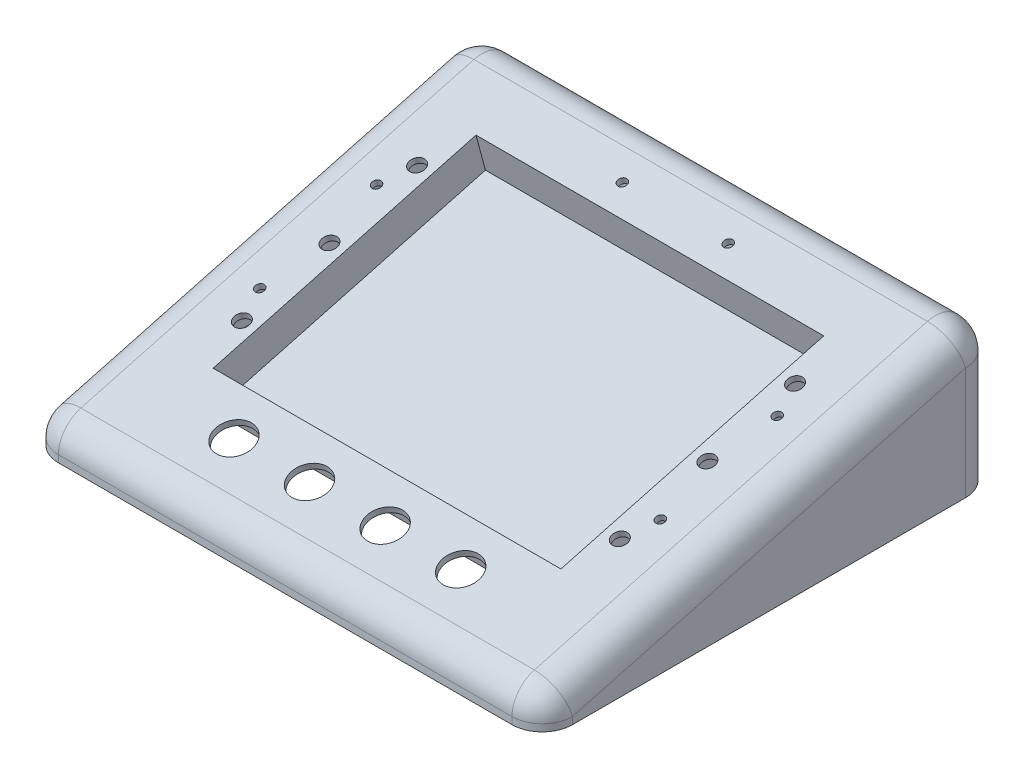
from build123d import *

# Parameters (mm, degrees)
SKETCH1_W                                  = 170
SKETCH1_H                                  = 150
BOSS_EXTRUDE1_DEPTH                        = 10
BOSS_EXTRUDE2_DEPTH                        = 170
FILLET1_R                                  = 10
SHELL1_T                                   = -2
SKETCH3_W                                  = 115
SKETCH3_H                                  = 90
CUT_EXTRUDE1_DEPTH                         = 2
SKETCH4_W                                  = 119
SKETCH4_H                                  = 94
SKETCH4_W_2                                = 115
SKETCH4_H_2                                = 90
BOSS_EXTRUDE3_DEPTH                        = 10
SKETCH5_W                                  = 119
SKETCH5_H                                  = 94
BOSS_EXTRUDE4_DEPTH                        = 2
SKETCH6_R                                  = 2.5
CUT_EXTRUDE2_DEPTH                         = 2
SKETCH7_R                                  = 6
CUT_EXTRUDE3_DEPTH                         = 2
SKETCH9_W                                  = 10
SKETCH9_H                                  = 15
BOSS_EXTRUDE5_DEPTH                        = 10
SKETCH10_W                                 = 5
SKETCH10_H                                 = 10
CUT_EXTRUDE4_DEPTH                         = 5
MIRROR1_AT_THE_SECOND_PLANE_COPY_1_SKETC_W = 10
MIRROR1_AT_THE_SECOND_PLANE_COPY_1_SKETC_H = 15
MIRROR1_AT_THE_SECOND_PLANE_COPY_1_DEPTH   = 10
MIRROR1_AT_THE_SECOND_PLANE_COPY_2_SKETC_W = 5
MIRROR1_AT_THE_SECOND_PLANE_COPY_2_SKETC_H = 10
MIRROR1_AT_THE_SECOND_PLANE_COPY_2_DEPTH   = 5
FILLET2_R                                  = 2
SKETCH11_R                                 = 1.5
CUT_EXTRUDE5_DEPTH                         = 2


with BuildPart() as part:
    # Sketch1 → Boss-Extrude1 (new body)
    with BuildSketch(Plane(origin=(0, 0, 0), x_dir=(1, 0, 0), z_dir=(0, 1, 0))):
        Rectangle(SKETCH1_W, SKETCH1_H)
    extrude(amount=BOSS_EXTRUDE1_DEPTH)

    # Sketch2 → Boss-Extrude2 (add)
    with BuildSketch(Plane.ZY.offset(85)):
        Polygon((-75, 10), (-75, 50.192378865), (75, 10), align=None)
    extrude(amount=-BOSS_EXTRUDE2_DEPTH)

    # Fillet1
    fillet1_edges = [part.edges().sort_by_distance(p)[0] for p in [
        (0, 50.192378865, -75),
        (-85, 30.096189432, 0),
        (85, 30.096189432, 0),
        (0, 10, 75),
        (85, 5, 75),
        (-85, 5, 75),
        (-85, 25.096189432, -75),
        (85, 25.096189432, -75),
    ]]
    fillet(fillet1_edges, radius=FILLET1_R)

    # Shell1
    shell1_openings = [part.faces().sort_by_distance(p)[0] for p in [
        (0, 0, 0),
    ]]
    offset(amount=SHELL1_T, openings=shell1_openings, kind=Kind.INTERSECTION)

    # Sketch3 → Cut-Extrude1 (cut)
    with BuildSketch(Plane(origin=(0, 28.080127019, 7.524047358), x_dir=(1, 0, 0), z_dir=(0, 0.96592582628907, 0.25881904510251436))):
        with Locations((0, 10)):
            Rectangle(SKETCH3_W, SKETCH3_H)
    extrude(amount=-CUT_EXTRUDE1_DEPTH, mode=Mode.SUBTRACT)

    # Sketch4 → Boss-Extrude3 (add)
    with BuildSketch(Plane(origin=(0, 26.148275366, 7.006409268), x_dir=(1, 0, 0), z_dir=(0, -0.96592582628907, -0.25881904510251436))):
        with Locations((0, -10)):
            Rectangle(SKETCH4_W, SKETCH4_H)
        with Locations((0, -10)):
            Rectangle(SKETCH4_W_2, SKETCH4_H_2, mode=Mode.SUBTRACT)
    extrude(amount=BOSS_EXTRUDE3_DEPTH)

    # Sketch5 → Boss-Extrude4 (add)
    with BuildSketch(Plane(origin=(0, 16.489017103, 4.418218817), x_dir=(1, 0, 0), z_dir=(0, -0.96592582628907, -0.25881904510251436))):
        with Locations((0, -10)):
            Rectangle(SKETCH5_W, SKETCH5_H)
    extrude(amount=BOSS_EXTRUDE4_DEPTH)

    # Sketch6 → Cut-Extrude2 (cut)
    with BuildSketch(Plane(origin=(0, 28.080127019, 7.524047358), x_dir=(1, 0, 0), z_dir=(0, 0.96592582628907, 0.25881904510251436))):
        with Locations(Location((-62.5, 10, 0), (0, 0, 270))):
            Circle(SKETCH6_R)
        with Locations(Location((-62.5, 40, 0), (0, 0, 270))):
            Circle(SKETCH6_R)
        with Locations(Location((-62.5, -20, 0), (0, 0, 270))):
            Circle(SKETCH6_R)
        with Locations(Location((62.5, -20, 0), (0, 0, 270))):
            Circle(SKETCH6_R)
        with Locations(Location((62.5, 40, 0), (0, 0, 270))):
            Circle(SKETCH6_R)
        with Locations(Location((62.5, 10, 0), (0, 0, 270))):
            Circle(SKETCH6_R)
    extrude(amount=-CUT_EXTRUDE2_DEPTH, mode=Mode.SUBTRACT)

    # Sketch7 → Cut-Extrude3 (cut)
    with BuildSketch(Plane(origin=(0, 28.080127019, 7.524047358), x_dir=(1, 0, 0), z_dir=(0, 0.96592582628907, 0.25881904510251436))):
        with Locations(Location((-12.5, -48.59148832, 0), (0, 0, 270))):
            Circle(SKETCH7_R)
        with Locations(Location((12.5, -48.59148832, 0), (0, 0, 270))):
            Circle(SKETCH7_R)
        with Locations(Location((37.5, -48.59148832, 0), (0, 0, 270))):
            Circle(SKETCH7_R)
        with Locations(Location((-37.5, -48.59148832, 0), (0, 0, 270))):
            Circle(SKETCH7_R)
    extrude(amount=-CUT_EXTRUDE3_DEPTH, mode=Mode.SUBTRACT)

    # Sketch9 → Boss-Extrude5 (add)
    with BuildSketch(Plane.XZ):
        with Locations((-78, -47.5)):
            Rectangle(SKETCH9_W, SKETCH9_H)
    boss_extrude5 = extrude(amount=-BOSS_EXTRUDE5_DEPTH)

    # Sketch10 → Cut-Extrude4 (cut)
    with BuildSketch(Plane.XZ):
        with Locations((-78, -47.5)):
            Rectangle(SKETCH10_W, SKETCH10_H)
    cut_extrude4 = extrude(amount=-CUT_EXTRUDE4_DEPTH, mode=Mode.SUBTRACT)

    # Mirror1: Boss-Extrude5, Cut-Extrude4 across plane
    add(boss_extrude5.mirror(Plane(origin=(0, 0, 0), x_dir=(0, 0, 1), z_dir=(1, 0, 0))))
    add(cut_extrude4.mirror(Plane(origin=(0, 0, 0), x_dir=(0, 0, 1), z_dir=(1, 0, 0))), mode=Mode.SUBTRACT)

    # Mirror1 at the second plane: Boss-Extrude5, Cut-Extrude4 across plane
    add(boss_extrude5.mirror(Plane.XY))
    add(cut_extrude4.mirror(Plane.XY), mode=Mode.SUBTRACT)

    # Mirror1 at the second plane copy 1 sketc → Mirror1 at the second plane copy 1 (add)
    with BuildSketch(Plane(origin=(0, 0, 0), x_dir=(-1, 0, 0), z_dir=(0, -1, 0))):
        with Locations((-78, -47.5)):
            Rectangle(MIRROR1_AT_THE_SECOND_PLANE_COPY_1_SKETC_W, MIRROR1_AT_THE_SECOND_PLANE_COPY_1_SKETC_H)
    extrude(amount=-MIRROR1_AT_THE_SECOND_PLANE_COPY_1_DEPTH)

    # Mirror1 at the second plane copy 2 sketc → Mirror1 at the second plane copy 2 (cut)
    with BuildSketch(Plane(origin=(0, 0, 0), x_dir=(-1, 0, 0), z_dir=(0, -1, 0))):
        with Locations((-78, -47.5)):
            Rectangle(MIRROR1_AT_THE_SECOND_PLANE_COPY_2_SKETC_W, MIRROR1_AT_THE_SECOND_PLANE_COPY_2_SKETC_H)
    extrude(amount=-MIRROR1_AT_THE_SECOND_PLANE_COPY_2_DEPTH, mode=Mode.SUBTRACT)

    # Fillet2
    fillet2_edges = [part.edges().sort_by_distance(p)[0] for p in [
        (-73, 5, -40),
        (-73, 5, -55),
        (-73, 5, 40),
        (-73, 5, 55),
        (73, 5, -55),
        (73, 5, -40),
        (73, 5, 55),
        (73, 5, 40),
    ]]
    fillet(fillet2_edges, radius=FILLET2_R)

    # Sketch11 → Cut-Extrude5 (cut)
    with BuildSketch(Plane(origin=(0, 28.080127019, 7.524047358), x_dir=(1, 0, 0), z_dir=(0, 0.96592582628907, 0.25881904510251436))):
        with Locations(Location((-17.5, 63.701463406, 0), (0, 0, 270))):
            Circle(SKETCH11_R)
        with Locations(Location((17.5, 63.701463406, 0), (0, 0, 270))):
            Circle(SKETCH11_R)
        with Locations(Location((-66.25, -10, 0), (0, 0, 270))):
            Circle(SKETCH11_R)
        with Locations(Location((66.25, -10, 0), (0, 0, 270))):
            Circle(SKETCH11_R)
        with Locations(Location((-66.25, 30, 0), (0, 0, 270))):
            Circle(SKETCH11_R)
        with Locations(Location((66.25, 30, 0), (0, 0, 270))):
            Circle(SKETCH11_R)
    extrude(amount=-CUT_EXTRUDE5_DEPTH, mode=Mode.SUBTRACT)


solid = part.part
